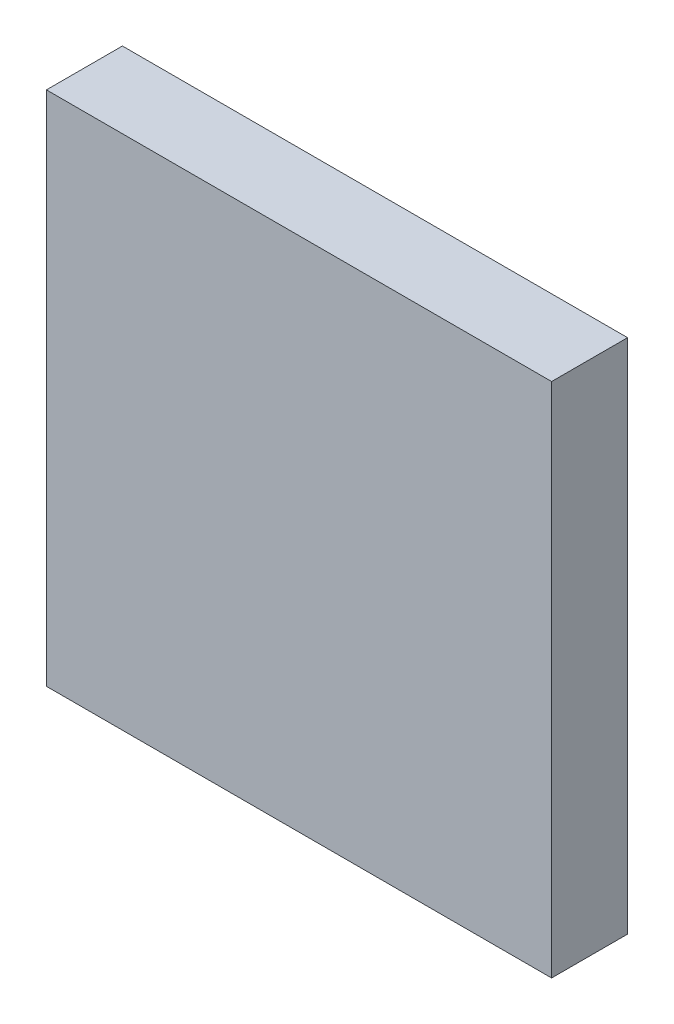
from build123d import *

# Parameters (mm, degrees)
ESBO_O1_W                = 66.5
ESBO_O1_H                = 68
RESSALTO_EXTRUS_O1_DEPTH = 10


with BuildPart() as part:
    # Esboço1 → Ressalto-extrusão1 (new body)
    with BuildSketch(Plane.XY):
        Rectangle(ESBO_O1_W, ESBO_O1_H)
    extrude(amount=RESSALTO_EXTRUS_O1_DEPTH)


solid = part.part
